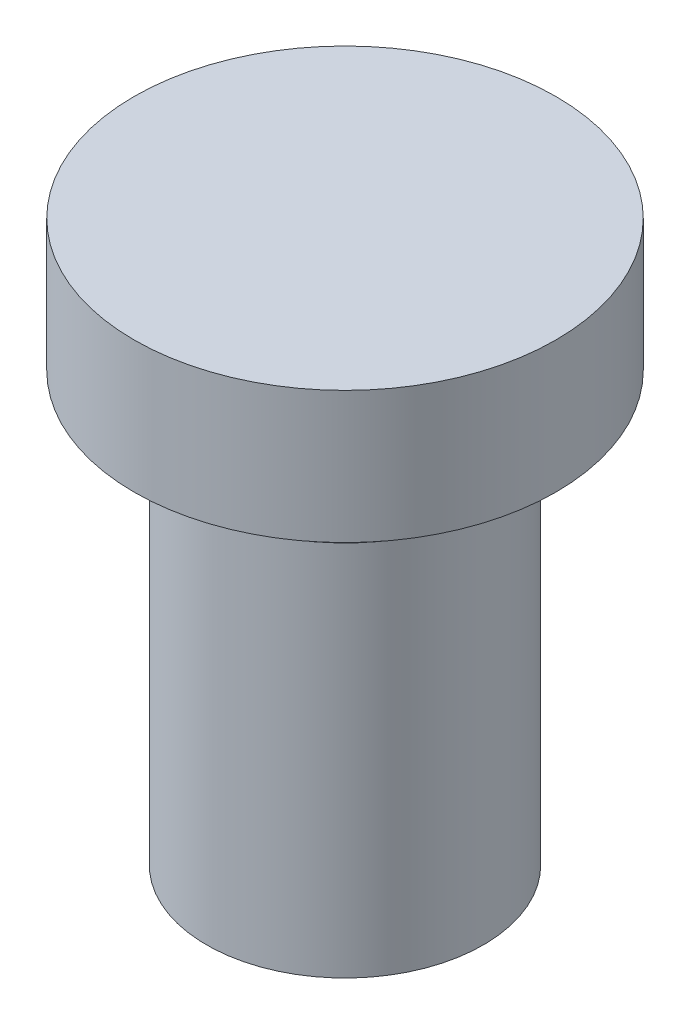
from build123d import *


with BuildPart() as part:
    # Sketch1 → Revolve1 (revolve)
    with BuildSketch(Plane.XY, mode=Mode.PRIVATE) as revolve1_sk:
        Polygon((0, 0), (0, 4.25), (1.6, 4.25), (1.6, 3.25), (1.25, 3.25), (1.25, 3), (1.05, 3), (1.05, 0), align=None)
    revolve(revolve1_sk.sketch.rotate(Axis((0, 0, 0), (0, 1, 0)), 90), axis=Axis((0, 0, 0), (0, 1, 0)))


solid = part.part
